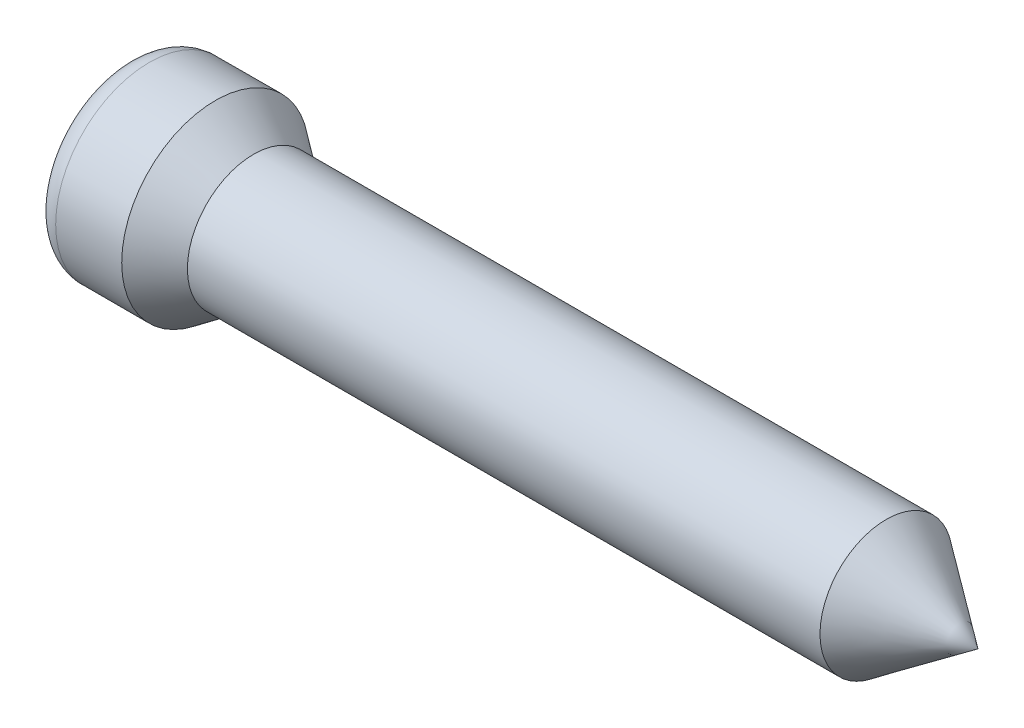
from build123d import *

# Parameters (mm, degrees)
FILLET1_R = 0.762


with BuildPart() as part:
    # Sketch1 → Revolve1 (revolve)
    with BuildSketch(Plane.XY, mode=Mode.PRIVATE) as revolve1_sk:
        Polygon((-4.2164, 3.048), (-4.2164, 0), (0, 0), (23.495, 0), (20.508761383, 2.152787351), (-0.065238617, 2.152787351), (-1.307032694, 3.048), align=None)
    revolve(revolve1_sk.sketch.rotate(Axis((-4.2164, 0, 0), (1, 0, 0)), 90), axis=Axis((-4.2164, 0, 0), (1, 0, 0)))

    # Fillet1
    fillet1_edges = [part.edges().sort_by_distance(p)[0] for p in [
        (-4.2164, 0, -3.048),
    ]]
    fillet(fillet1_edges, radius=FILLET1_R)


solid = part.part
